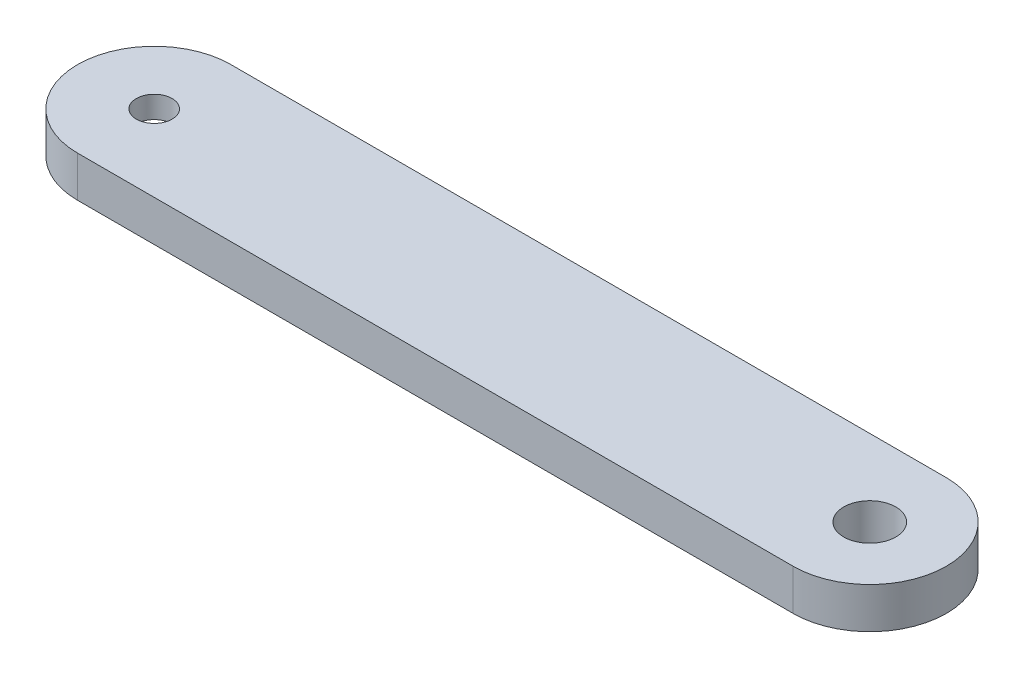
from build123d import *

# Parameters (mm, degrees)
SCHIZZO2_R                   = 5.1
SCHIZZO2_R_2                 = 3.5
ESTRUSIONE_ESTRUSIONE1_DEPTH = 8
SCHIZZO4_R                   = 11
TAGLIO_ESTRUSIONE1_DEPTH     = 3.7
SCHIZZO5_R                   = 1.1
TAGLIO_ESTRUSIONE2_DEPTH     = 3


with BuildPart() as part:
    # Schizzo2 → Estrusione-Estrusione1 (new body)
    with BuildSketch(Plane(origin=(0, 0, 0), x_dir=(1, 0, 0), z_dir=(0, 1, 0))):
        with BuildLine():
            Line((70, -15), (-70, -15))
            ThreePointArc((-70, -15), (-85, 0), (-70, 15))
            Line((-70, 15), (70, 15))
            ThreePointArc((70, 15), (85, 0), (70, -15))
        make_face()
        with Locations(Location((70, 0, 0), (0, 0, 270))):
            Circle(SCHIZZO2_R, mode=Mode.SUBTRACT)
        with Locations(Location((-70, 0, 0), (0, 0, 270))):
            Circle(SCHIZZO2_R_2, mode=Mode.SUBTRACT)
    extrude(amount=ESTRUSIONE_ESTRUSIONE1_DEPTH)

    # Schizzo4 → Taglio-Estrusione1 (cut)
    with BuildSketch(Plane.XZ):
        with Locations(Location((-70, 0, 0), (0, 0, 270))):
            Circle(SCHIZZO4_R)
    extrude(amount=-TAGLIO_ESTRUSIONE1_DEPTH, mode=Mode.SUBTRACT)

    # Schizzo5 → Taglio-Estrusione2 (cut)
    with BuildSketch(Plane.XZ.offset(-3.7)):
        with Locations(Location((-75.66, 5.66, 0), (0, 0, 270))):
            Circle(SCHIZZO5_R)
        with Locations(Location((-64.34, 5.66, 0), (0, 0, 90))):
            Circle(SCHIZZO5_R)
        with Locations(Location((-64.34, -5.66, 0), (0, 0, 270))):
            Circle(SCHIZZO5_R)
        with Locations(Location((-75.66, -5.66, 0), (0, 0, 90))):
            Circle(SCHIZZO5_R)
    extrude(amount=-TAGLIO_ESTRUSIONE2_DEPTH, mode=Mode.SUBTRACT)


solid = part.part
